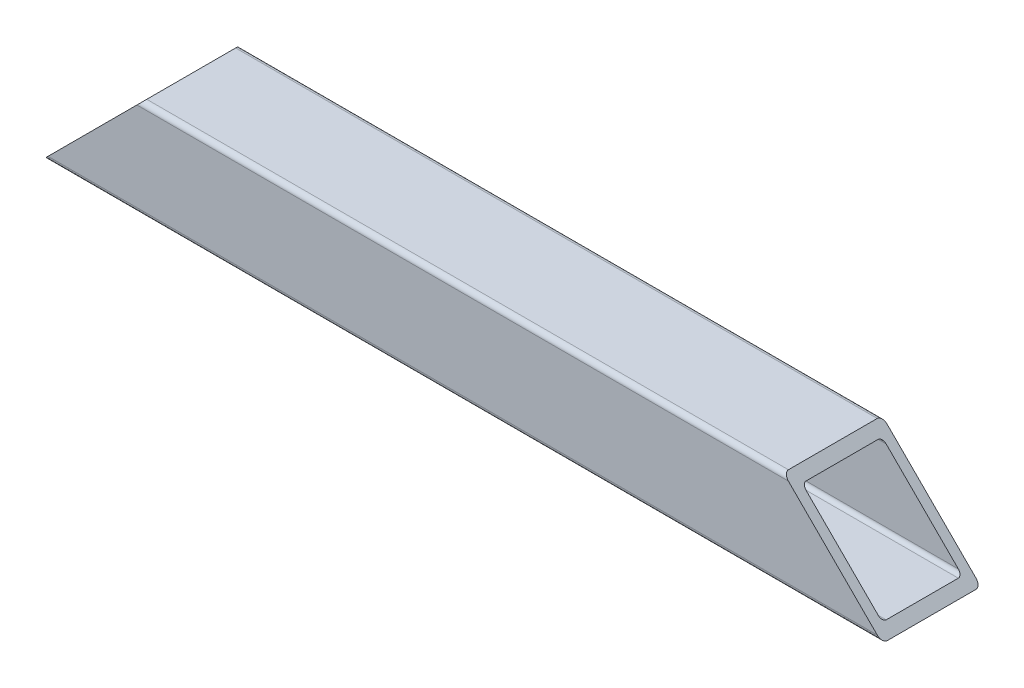
from build123d import *

# Parameters (mm, degrees)
SQUARE_TUBE_2X2X188_A500_1_DEPTH = 431.8
CUT_EXTRUDE1_DEPTH               = 436.519276267


with BuildPart() as part:
    # Sketch12 → Square tube 2X2X188 A500(1) (new body)
    with BuildSketch(Plane(origin=(0, 0, 0), x_dir=(0, -1, 0), z_dir=(-1, 0, 0))):
        with BuildLine():
            Line((22.86, -25.4), (-22.86, -25.4))
            ThreePointArc((-22.86, -25.4), (-24.656051224, -24.656051224), (-25.4, -22.86))
            Line((-25.4, -22.86), (-25.4, 22.86))
            ThreePointArc((-25.4, 22.86), (-24.656051224, 24.656051224), (-22.86, 25.4))
            Line((-22.86, 25.4), (22.86, 25.4))
            ThreePointArc((22.86, 25.4), (24.656051224, 24.656051224), (25.4, 22.86))
            Line((25.4, 22.86), (25.4, -22.86))
            ThreePointArc((25.4, -22.86), (24.656051224, -24.656051224), (22.86, -25.4))
        make_face()
        with BuildLine():
            Line((18.56232, 20.6248), (-18.56232, 20.6248))
            ThreePointArc((-18.56232, 20.6248), (-20.020713594, 20.020713594), (-20.6248, 18.56232))
            Line((-20.6248, 18.56232), (-20.6248, -18.56232))
            ThreePointArc((-20.6248, -18.56232), (-20.020713594, -20.020713594), (-18.56232, -20.6248))
            Line((-18.56232, -20.6248), (18.56232, -20.6248))
            ThreePointArc((18.56232, -20.6248), (20.020713594, -20.020713594), (20.6248, -18.56232))
            Line((20.6248, -18.56232), (20.6248, 18.56232))
            ThreePointArc((20.6248, 18.56232), (20.020713594, 20.020713594), (18.56232, 20.6248))
        make_face(mode=Mode.SUBTRACT)
    extrude(amount=SQUARE_TUBE_2X2X188_A500_1_DEPTH)

    # Sketch14 → Cut-Extrude1 (cut, through all)
    with BuildSketch(Plane.XY.offset(25.4)):
        Polygon((-431.8, -25.4), (-431.8, 25.4), (-381, 25.4), align=None)
        Polygon((0, -25.4), (0, 25.4), (-50.8, 25.4), align=None)
    extrude(amount=-CUT_EXTRUDE1_DEPTH, mode=Mode.SUBTRACT)


solid = part.part
